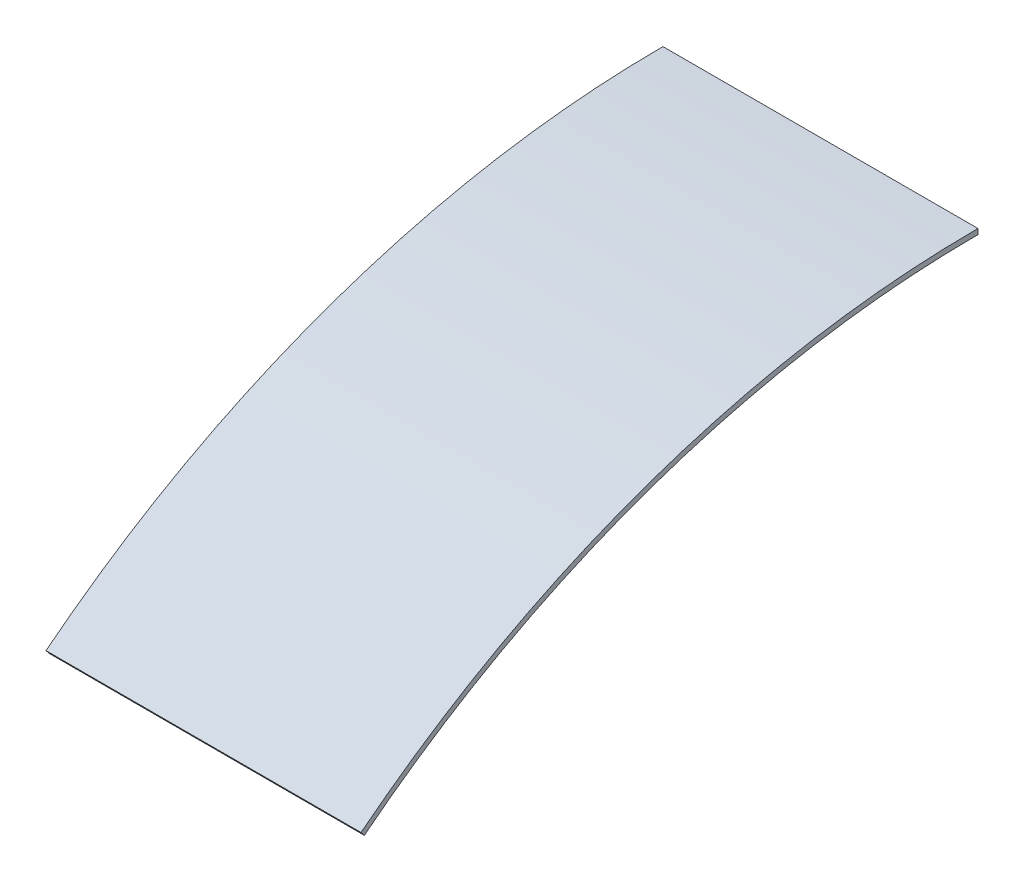
from build123d import *

# Parameters (mm, degrees)
BOSS_EXTRUDE1_DEPTH = 177.8


with BuildPart() as part:
    # Sketch1 → Boss-Extrude1 (new body)
    with BuildSketch(Plane(origin=(0, 0, 0), x_dir=(0, 0, -1), z_dir=(1, 0, 0))):
        with BuildLine():
            Line((-347.287652839, -122.286543799), (-346.357708466, -123.46170567))
            ThreePointArc((-346.357708466, -123.46170567), (-183.35441046, -33.972848847), (0, -2.9972))
            Line((0, -2.9972), (0, -1.4986))
            ThreePointArc((0, -1.4986), (-183.846703249, -32.557416132), (-347.287652839, -122.286543799))
        make_face()
        with BuildLine():
            Line((-348.217597212, -121.111381928), (-347.287652839, -122.286543799))
            ThreePointArc((-347.287652839, -122.286543799), (-183.846703249, -32.557416132), (0, -1.4986))
            Line((0, -1.4986), (0, 0))
            ThreePointArc((0, 0), (-184.338996038, -31.141983417), (-348.217597212, -121.111381928))
        make_face()
    extrude(amount=BOSS_EXTRUDE1_DEPTH)


solid = part.part
